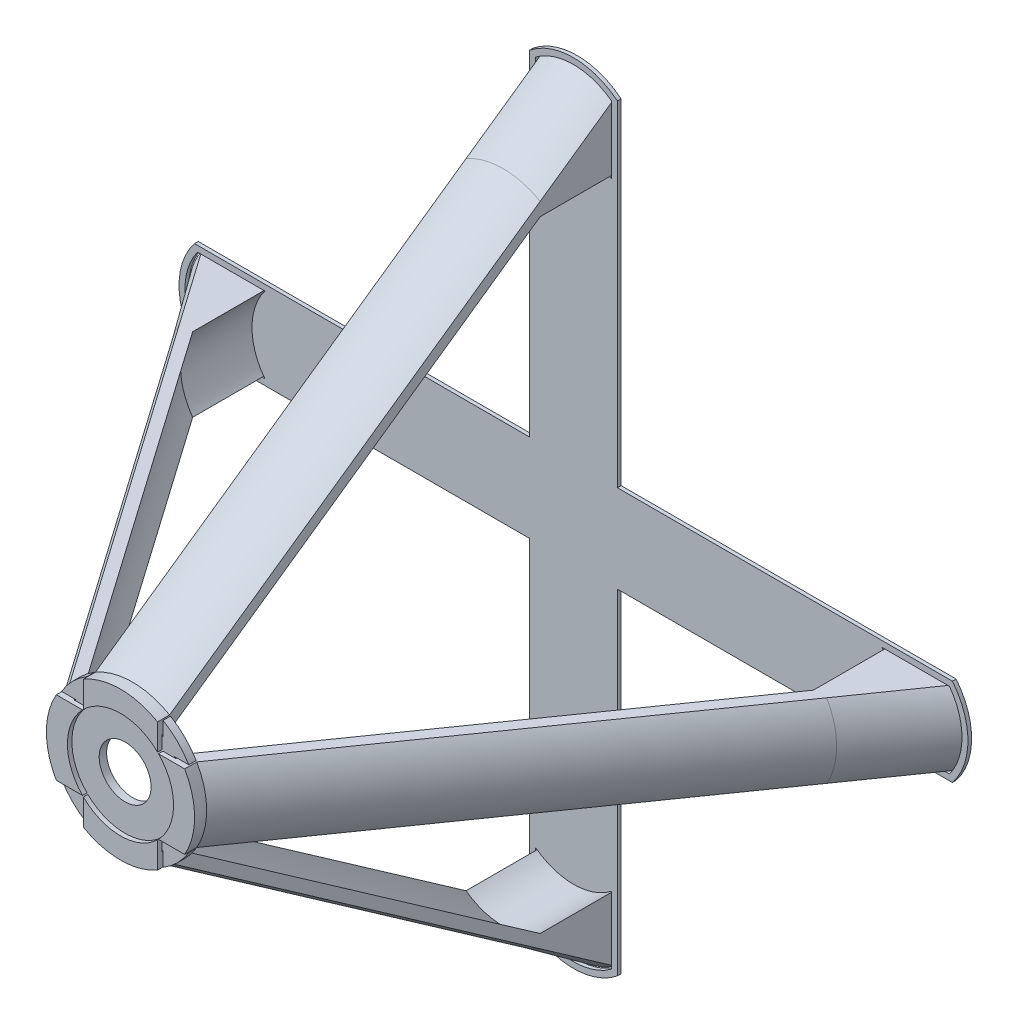
from build123d import *
from build123d.topology import SkipClean

# Parameters (mm, degrees)
SKETCH1_R           = 20
SKETCH1_R_2         = 7
BOSS_EXTRUDE1_DEPTH = 2
BOSS_EXTRUDE3_DEPTH = 20
CUT_EXTRUDE1_DEPTH  = 152.339803484
BOSS_EXTRUDE4_DEPTH = 1.25
BOSS_EXTRUDE5_DEPTH = 1.2
CIRPATTERN3_COUNT   = 4
BOSS_EXTRUDE6_DEPTH = 1


with BuildPart() as part:
    # Sketch1 → Boss-Extrude1 (new body)
    with BuildSketch(Plane.XY):
        Circle(SKETCH1_R)
        Circle(SKETCH1_R_2, mode=Mode.SUBTRACT)
    extrude(amount=BOSS_EXTRUDE1_DEPTH)

    # Sweep1: sweep along a path in Sketch2
    with BuildLine(Plane(origin=(0, 0, 0), x_dir=(1, 0, 0), z_dir=(0, 1, 0))) as sweep1_path:
        Line((-20, 0), (-90.020753821, 100))
    # Sketch3 → Sweep1 (sweep)
    with BuildSketch(Plane(origin=(0, 0, 0), x_dir=(-1, 0, 0), z_dir=(0, 0, -1))):
        with BuildLine():
            Line((13.747727085, -10), (17.320508076, -10))
            ThreePointArc((17.320508076, -10), (20, 0), (17.320508076, 10))
            Line((17.320508076, 10), (13.747727085, 10))
            ThreePointArc((13.747727085, 10), (17, 0), (13.747727085, -10))
        make_face()
    sweep(path=sweep1_path.line)

    # Sketch4 → Boss-Extrude3 (add)
    with BuildSketch(Plane(origin=(0, 0, -100), x_dir=(-1, 0, 0), z_dir=(0, 0, -1))):
        with BuildLine():
            Line((87.341261897, -10), (83.768480906, -10))
            ThreePointArc((83.768480906, -10), (87.020753821, 0), (83.768480906, 10))
            Line((83.768480906, 10), (87.341261897, 10))
            ThreePointArc((87.341261897, 10), (90.020753821, 0), (87.341261897, -10))
        make_face()
    extrude(amount=BOSS_EXTRUDE3_DEPTH)

    # Sketch5 → Cut-Extrude1 (cut, through all)
    # profile 1 of 4: a face of its own
    with BuildSketch(Plane(origin=(0, 0, 0), x_dir=(-1, 0, 0), z_dir=(0, 0, -1))):
        with BuildLine():
            Line((17.464249197, -10.25), (13.247641299, -10.25))
            ThreePointArc((13.247641299, -10.25), (16.75, 0), (13.247641299, 10.25))
            Line((13.247641299, 10.25), (17.464249197, 10.25))
            ThreePointArc((17.464249197, 10.25), (20.25, 0), (17.464249197, -10.25))
        make_face()
        with BuildLine():
            Line((17.320508076, -10), (13.747727085, -10))
            ThreePointArc((13.747727085, -10), (17, 0), (13.747727085, 10))
            Line((13.747727085, 10), (17.320508076, 10))
            ThreePointArc((17.320508076, 10), (20, 0), (17.320508076, -10))
        make_face(mode=Mode.SUBTRACT)
    # profile 2 of 4: a face of its own
    with BuildSketch(Plane(origin=(0, 0, 0), x_dir=(-1, 0, 0), z_dir=(0, 0, -1))):
        with BuildLine():
            Line((-10.25, -17.464249197), (-10.25, -13.247641299))
            ThreePointArc((-10.25, -13.247641299), (0, -16.75), (10.25, -13.247641299))
            Line((10.25, -13.247641299), (10.25, -17.464249197))
            ThreePointArc((10.25, -17.464249197), (0, -20.25), (-10.25, -17.464249197))
        make_face()
        with BuildLine():
            Line((-10, -17.320508076), (-10, -13.747727085))
            ThreePointArc((-10, -13.747727085), (0, -17), (10, -13.747727085))
            Line((10, -13.747727085), (10, -17.320508076))
            ThreePointArc((10, -17.320508076), (0, -20), (-10, -17.320508076))
        make_face(mode=Mode.SUBTRACT)
    # profile 3 of 4: a face of its own
    with BuildSketch(Plane(origin=(0, 0, 0), x_dir=(-1, 0, 0), z_dir=(0, 0, -1))):
        with BuildLine():
            Line((-17.464249197, 10.25), (-13.247641299, 10.25))
            ThreePointArc((-13.247641299, 10.25), (-16.75, 0), (-13.247641299, -10.25))
            Line((-13.247641299, -10.25), (-17.464249197, -10.25))
            ThreePointArc((-17.464249197, -10.25), (-20.25, 0), (-17.464249197, 10.25))
        make_face()
        with BuildLine():
            Line((-17.320508076, 10), (-13.747727085, 10))
            ThreePointArc((-13.747727085, 10), (-17, 0), (-13.747727085, -10))
            Line((-13.747727085, -10), (-17.320508076, -10))
            ThreePointArc((-17.320508076, -10), (-20, 0), (-17.320508076, 10))
        make_face(mode=Mode.SUBTRACT)
    # profile 4 of 4: a face of its own
    with BuildSketch(Plane(origin=(0, 0, 0), x_dir=(-1, 0, 0), z_dir=(0, 0, -1))):
        with BuildLine():
            Line((10.25, 17.464249197), (10.25, 13.247641299))
            ThreePointArc((10.25, 13.247641299), (0, 16.75), (-10.25, 13.247641299))
            Line((-10.25, 13.247641299), (-10.25, 17.464249197))
            ThreePointArc((-10.25, 17.464249197), (0, 20.25), (10.25, 17.464249197))
        make_face()
        with BuildLine():
            Line((10, 17.320508076), (10, 13.747727085))
            ThreePointArc((10, 13.747727085), (0, 17), (-10, 13.747727085))
            Line((-10, 13.747727085), (-10, 17.320508076))
            ThreePointArc((-10, 17.320508076), (0, 20), (10, 17.320508076))
        make_face(mode=Mode.SUBTRACT)
    extrude(amount=-CUT_EXTRUDE1_DEPTH, mode=Mode.SUBTRACT)


with BuildPart() as cut_extrude1_piece_1:
    # of the separate pieces the step leaves, piece 1, a body of its own (cut_extrude1_pieces_kept)
    add(part.part.solids().sort_by_distance((-17.320508076, 10, 2))[0])

    # Sketch6 → Boss-Extrude4 (add)
    with SkipClean():  # the faces are left unmerged after this step: merging them gives an invalid solid
        with BuildSketch(Plane.XY.offset(2)):
            with BuildLine():
                Line((-17.320508076, 10), (-13.747727085, 10))
                ThreePointArc((-13.747727085, 10), (-17, 0), (-13.747727085, -10))
                Line((-13.747727085, -10), (-17.320508076, -10))
                ThreePointArc((-17.320508076, -10), (-20, 0), (-17.320508076, 10))
            make_face()
        extrude(amount=BOSS_EXTRUDE4_DEPTH)

    # Sketch7 → Boss-Extrude5 (add)
    with SkipClean():  # the faces are left unmerged after this step: merging them gives an invalid solid
        with BuildSketch(Plane.XY.offset(3.25)):
            with BuildLine():
                Line((-13.747727085, 10), (-10.25, 10))
                ThreePointArc((-10.25, 10), (-14.320003492, 0), (-10.25, -10))
                Line((-10.25, -10), (-13.747727085, -10))
                ThreePointArc((-13.747727085, -10), (-17, 0), (-13.747727085, 10))
            make_face()
        extrude(amount=-BOSS_EXTRUDE5_DEPTH)

    # Sketch9 for Loft1 → Loft1 section 0
    with SkipClean():  # the faces are left unmerged after this step: merging them gives an invalid solid
        with BuildSketch(Plane(origin=(0, 0, -120), x_dir=(-1, 0, 0), z_dir=(0, 0, -1))):
            with BuildLine():
                Line((83.768480906, -10), (101.345412661, -10))
                # circular arc as an exact rational Bezier (weights 1, cos(half-angle), 1)
                Bezier((101.345412661, -10), (108.619342335, 0), (101.345412661, 10), weights=[1, 0.808689829, 1])
                Line((101.345412661, 10), (83.768480906, 10))
                Bezier((83.768480906, 10), (91.04241058, 0), (83.768480906, -10), weights=[1, 0.808689829, 1])
            make_face()
        # Sketch4<2> for Loft1 → Loft1 section 1
        with BuildSketch(Plane(origin=(0, 0, -100), x_dir=(-1, 0, 0), z_dir=(0, 0, -1))):
            with BuildLine():
                Line((87.341261897, -10), (83.768480906, -10))
                Bezier((83.768480906, -10), (91.04241058, 0), (83.768480906, 10), weights=[1, 0.808689829, 1])
                Line((83.768480906, 10), (87.341261897, 10))
                Bezier((87.341261897, 10), (93.114764589, 0), (87.341261897, -10), weights=[1, 0.866025404, 1])
            make_face()
        loft()


with BuildPart() as cut_extrude1_piece_2:
    # of the separate pieces the step leaves, piece 2, a body of its own (cut_extrude1_pieces_kept)
    add(part.part.solids().sort_by_distance((17.173744496, -10.25, 2))[0])


with BuildPart() as cirpattern3_1:
    # CirPattern3: pattern copy
    add(cut_extrude1_piece_1.part.rotate(Axis((0, 0, 0), (0, 0, -1)), 1 * 360 / CIRPATTERN3_COUNT))


with BuildPart() as cirpattern3_2:
    # CirPattern3: pattern copy
    add(cut_extrude1_piece_1.part.rotate(Axis((0, 0, 0), (0, 0, -1)), 2 * 360 / CIRPATTERN3_COUNT))


with BuildPart() as cirpattern3_3:
    # CirPattern3: pattern copy
    add(cut_extrude1_piece_1.part.rotate(Axis((0, 0, 0), (0, 0, -1)), 3 * 360 / CIRPATTERN3_COUNT))


with BuildPart() as body_6:
    # Sketch10 → Boss-Extrude6 (new body)
    with BuildSketch(Plane(origin=(0, 0, -120), x_dir=(-1, 0, 0), z_dir=(0, 0, -1))):
        with BuildLine():
            Line((11.85, -102.257153506), (11.85, -11.85))
            Line((11.85, -11.85), (102.257153506, -11.85))
            ThreePointArc((102.257153506, -11.85), (106.447685576, 0), (102.257153506, 11.85))
            Line((102.257153506, 11.85), (11.85, 11.85))
            Line((11.85, 11.85), (11.85, 102.257153506))
            ThreePointArc((11.85, 102.257153506), (0, 106.447685576), (-11.85, 102.257153506))
            Line((-11.85, 102.257153506), (-11.85, 11.85))
            Line((-11.85, 11.85), (-102.257153506, 11.85))
            ThreePointArc((-102.257153506, 11.85), (-106.447685576, 0), (-102.257153506, -11.85))
            Line((-102.257153506, -11.85), (-11.85, -11.85))
            Line((-11.85, -11.85), (-11.85, -102.257153506))
            ThreePointArc((-11.85, -102.257153506), (0, -106.447685576), (11.85, -102.257153506))
        make_face()
        with BuildLine():
            Line((101.472122501, 10.25), (83.26839512, 10.25))
            ThreePointArc((83.26839512, 10.25), (86.770753821, 0), (83.26839512, -10.25))
            Line((83.26839512, -10.25), (101.472122501, -10.25))
            ThreePointArc((101.472122501, -10.25), (104.847685576, 0), (101.472122501, 10.25))
        make_face(mode=Mode.SUBTRACT)
        with BuildLine():
            Line((-10.25, -101.472122501), (-10.25, -83.26839512))
            ThreePointArc((-10.25, -83.26839512), (0, -86.770753821), (10.25, -83.26839512))
            Line((10.25, -83.26839512), (10.25, -101.472122501))
            ThreePointArc((10.25, -101.472122501), (0, -104.847685576), (-10.25, -101.472122501))
        make_face(mode=Mode.SUBTRACT)
        with BuildLine():
            Line((-101.472122501, 10.25), (-83.26839512, 10.25))
            ThreePointArc((-83.26839512, 10.25), (-86.770753821, 0), (-83.26839512, -10.25))
            Line((-83.26839512, -10.25), (-101.472122501, -10.25))
            ThreePointArc((-101.472122501, -10.25), (-104.847685576, 0), (-101.472122501, 10.25))
        make_face(mode=Mode.SUBTRACT)
        with BuildLine():
            Line((10.25, 101.472122501), (10.25, 83.26839512))
            ThreePointArc((10.25, 83.26839512), (0, 86.770753821), (-10.25, 83.26839512))
            Line((-10.25, 83.26839512), (-10.25, 101.472122501))
            ThreePointArc((-10.25, 101.472122501), (0, 104.847685576), (10.25, 101.472122501))
        make_face(mode=Mode.SUBTRACT)
    extrude(amount=-BOSS_EXTRUDE6_DEPTH)


solid = Compound([cut_extrude1_piece_1.part, cut_extrude1_piece_2.part, cirpattern3_1.part, cirpattern3_2.part, cirpattern3_3.part, body_6.part])
